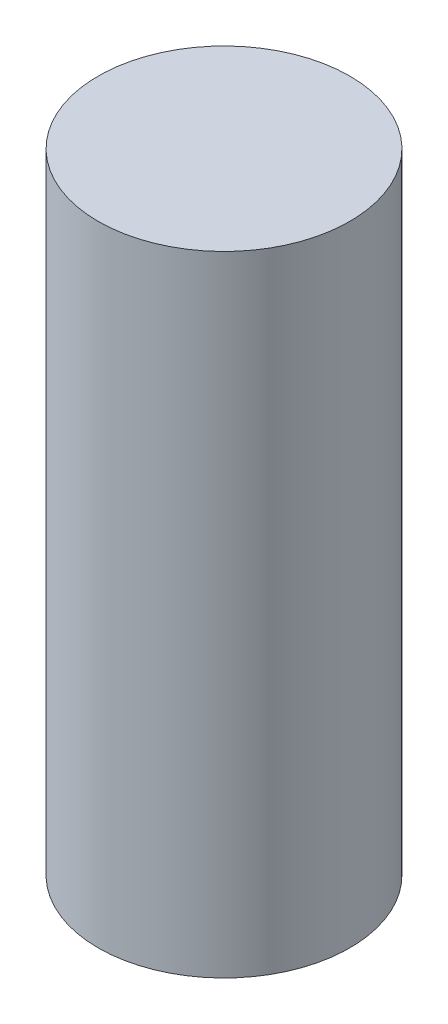
from build123d import *

# Parameters (mm, degrees)
SKETCH1_R           = 2
BOSS_EXTRUDE1_DEPTH = 10


with BuildPart() as part:
    # Sketch1 → Boss-Extrude1 (new body)
    with BuildSketch(Plane(origin=(0, 0, 0), x_dir=(1, 0, 0), z_dir=(0, 1, 0))):
        with Locations(Location((0, 0, 0), (0, 0, 270))):
            Circle(SKETCH1_R)
    extrude(amount=BOSS_EXTRUDE1_DEPTH)


solid = part.part
